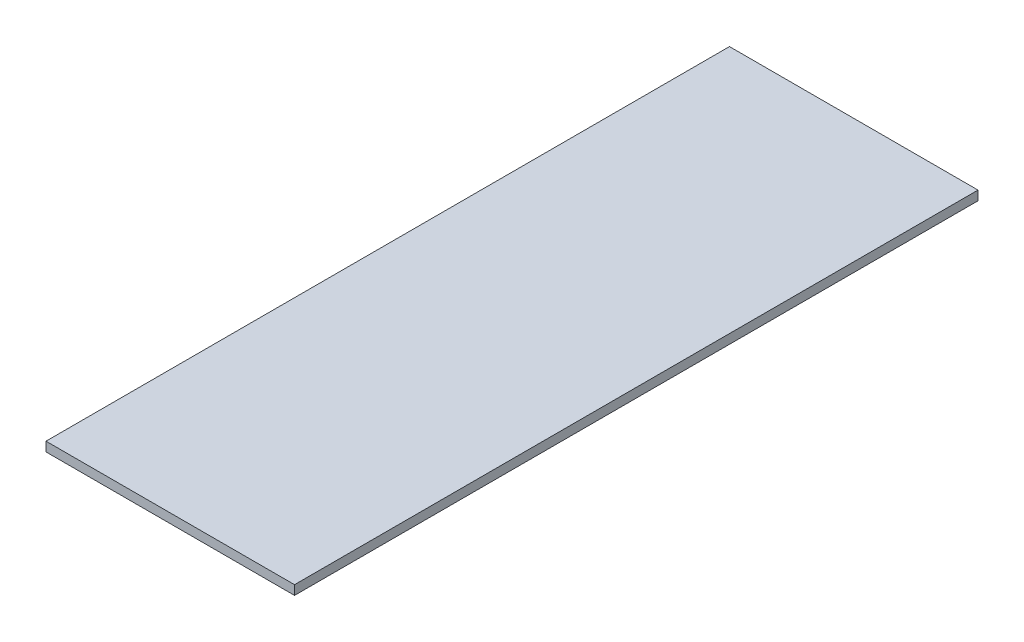
from build123d import *

# Parameters (mm, degrees)
CROQUIS1_W              = 8
CROQUIS1_H              = 22
SALIENTE_EXTRUIR1_DEPTH = 0.3


with BuildPart() as part:
    # Croquis1 → Saliente-Extruir1 (new body)
    with BuildSketch(Plane(origin=(0, 0, 0), x_dir=(1, 0, 0), z_dir=(0, 1, 0))):
        with Locations((-5.423157461, 12.261363636)):
            Rectangle(CROQUIS1_W, CROQUIS1_H)
    extrude(amount=SALIENTE_EXTRUIR1_DEPTH)


solid = part.part
